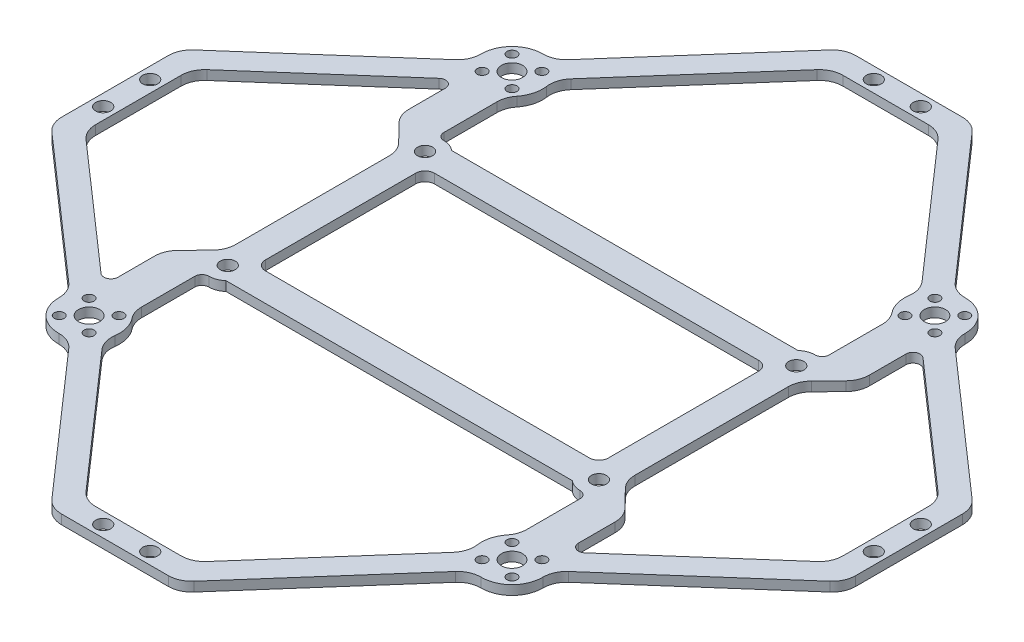
from build123d import *

# Parameters (mm, degrees)
SKETCH_1_R      = 1.6
SKETCH_1_R_2    = 2.25
SKETCH_1_R_3    = 1.05
EXTRUDE_2_DEPTH = 2


with BuildPart() as part:
    # 草图1 → 凸台-拉伸2 (new body)
    with BuildSketch(Plane(origin=(0, 0, 0), x_dir=(1, 0, 0), z_dir=(0, 1, 0))):
        with BuildLine():
            Line((-41.125061415, 53.199686028), (-15.125044792, 82.799704953))
            ThreePointArc((-15.125044792, 82.799704953), (-13.430189318, 84.055135825), (-11.368457614, 84.5))
            Line((-11.368457614, 84.5), (11.368457614, 84.5))
            ThreePointArc((11.368457614, 84.5), (13.430189318, 84.055135825), (15.125044792, 82.799704953))
            Line((15.125044792, 82.799704953), (41.125061415, 53.199686028))
            ThreePointArc((41.125061415, 53.199686028), (42.843383919, 51.933706244), (44.933105726, 51.499655772))
            ThreePointArc((44.933105726, 51.499655772), (49.596194078, 49.596194078), (51.499655772, 44.933105726))
            ThreePointArc((51.499655772, 44.933105726), (51.933706244, 42.843383919), (53.199686028, 41.125061415))
            Line((53.199686028, 41.125061415), (82.799704953, 15.125044792))
            ThreePointArc((82.799704953, 15.125044792), (84.055135825, 13.430189318), (84.5, 11.368457614))
            Line((84.5, 11.368457614), (84.5, -11.368457614))
            ThreePointArc((84.5, -11.368457614), (84.055135825, -13.430189318), (82.799704953, -15.125044792))
            Line((82.799704953, -15.125044792), (53.199686028, -41.125061415))
            ThreePointArc((53.199686028, -41.125061415), (51.933706244, -42.843383919), (51.499655772, -44.933105726))
            ThreePointArc((51.499655772, -44.933105726), (49.596194078, -49.596194078), (44.933105726, -51.499655772))
            ThreePointArc((44.933105726, -51.499655772), (42.843383919, -51.933706244), (41.125061415, -53.199686028))
            Line((41.125061415, -53.199686028), (15.125044792, -82.799704953))
            ThreePointArc((15.125044792, -82.799704953), (13.430189318, -84.055135825), (11.368457614, -84.5))
            Line((11.368457614, -84.5), (-11.368457614, -84.5))
            ThreePointArc((-11.368457614, -84.5), (-13.430189318, -84.055135825), (-15.125044792, -82.799704953))
            Line((-15.125044792, -82.799704953), (-41.125061415, -53.199686028))
            ThreePointArc((-41.125061415, -53.199686028), (-42.843383919, -51.933706244), (-44.933105726, -51.499655772))
            ThreePointArc((-44.933105726, -51.499655772), (-49.596194078, -49.596194078), (-51.499655772, -44.933105726))
            ThreePointArc((-51.499655772, -44.933105726), (-51.933706244, -42.843383919), (-53.199686028, -41.125061415))
            Line((-53.199686028, -41.125061415), (-82.799704953, -15.125044792))
            ThreePointArc((-82.799704953, -15.125044792), (-84.055135825, -13.430189318), (-84.5, -11.368457614))
            Line((-84.5, -11.368457614), (-84.5, 11.368457614))
            ThreePointArc((-84.5, 11.368457614), (-84.055135825, 13.430189318), (-82.799704953, 15.125044792))
            Line((-82.799704953, 15.125044792), (-53.199686028, 41.125061415))
            ThreePointArc((-53.199686028, 41.125061415), (-51.933706244, 42.843383919), (-51.499655772, 44.933105726))
            ThreePointArc((-51.499655772, 44.933105726), (-49.596194078, 49.596194078), (-44.933105726, 51.499655772))
            ThreePointArc((-44.933105726, 51.499655772), (-42.843383919, 51.933706244), (-41.125061415, 53.199686028))
        make_face()
        with Locations(Location((-39.5, 21, 0), (0, 0, 270))):
            Circle(SKETCH_1_R, mode=Mode.SUBTRACT)
        with Locations(Location((39.5, 21, 0), (0, 0, 270))):
            Circle(SKETCH_1_R, mode=Mode.SUBTRACT)
        with Locations(Location((39.5, -21, 0), (0, 0, 270))):
            Circle(SKETCH_1_R, mode=Mode.SUBTRACT)
        with Locations(Location((-39.5, -21, 0), (0, 0, 270))):
            Circle(SKETCH_1_R, mode=Mode.SUBTRACT)
        with Locations(Location((45, 45, 0), (0, 0, 270))):
            Circle(SKETCH_1_R_2, mode=Mode.SUBTRACT)
        with Locations(Location((48.181980515, 48.181980515, 0), (0, 0, 270))):
            Circle(SKETCH_1_R_3, mode=Mode.SUBTRACT)
        with Locations(Location((5, 82, 0), (0, 0, 270))):
            Circle(SKETCH_1_R, mode=Mode.SUBTRACT)
        with Locations(Location((-5, 82, 0), (0, 0, 270))):
            Circle(SKETCH_1_R, mode=Mode.SUBTRACT)
        with Locations(Location((82, 5, 0), (0, 0, 270))):
            Circle(SKETCH_1_R, mode=Mode.SUBTRACT)
        with Locations(Location((82, -5, 0), (0, 0, 270))):
            Circle(SKETCH_1_R, mode=Mode.SUBTRACT)
        with Locations(Location((5, -82, 0), (0, 0, 270))):
            Circle(SKETCH_1_R, mode=Mode.SUBTRACT)
        with Locations(Location((-5, -82, 0), (0, 0, 270))):
            Circle(SKETCH_1_R, mode=Mode.SUBTRACT)
        with Locations(Location((-82, -5, 0), (0, 0, 270))):
            Circle(SKETCH_1_R, mode=Mode.SUBTRACT)
        with Locations(Location((-82, 5, 0), (0, 0, 270))):
            Circle(SKETCH_1_R, mode=Mode.SUBTRACT)
        with Locations(Location((48.181980515, 41.818019485, 0), (0, 0, 270))):
            Circle(SKETCH_1_R_3, mode=Mode.SUBTRACT)
        with Locations(Location((41.818019485, 41.818019485, 0), (0, 0, 270))):
            Circle(SKETCH_1_R_3, mode=Mode.SUBTRACT)
        with Locations(Location((41.818019485, 48.181980515, 0), (0, 0, 270))):
            Circle(SKETCH_1_R_3, mode=Mode.SUBTRACT)
        with Locations(Location((48.181980515, -41.818019485, 0), (0, 0, 270))):
            Circle(SKETCH_1_R_3, mode=Mode.SUBTRACT)
        with Locations(Location((48.181980515, -48.181980515, 0), (0, 0, 270))):
            Circle(SKETCH_1_R_3, mode=Mode.SUBTRACT)
        with Locations(Location((45, -45, 0), (0, 0, 270))):
            Circle(SKETCH_1_R_2, mode=Mode.SUBTRACT)
        with Locations(Location((41.818019485, -41.818019485, 0), (0, 0, 270))):
            Circle(SKETCH_1_R_3, mode=Mode.SUBTRACT)
        with Locations(Location((41.818019485, -48.181980515, 0), (0, 0, 270))):
            Circle(SKETCH_1_R_3, mode=Mode.SUBTRACT)
        with Locations(Location((-41.818019485, -48.181980515, 0), (0, 0, 270))):
            Circle(SKETCH_1_R_3, mode=Mode.SUBTRACT)
        with Locations(Location((-48.181980515, -48.181980515, 0), (0, 0, 270))):
            Circle(SKETCH_1_R_3, mode=Mode.SUBTRACT)
        with Locations(Location((-45, -45, 0), (0, 0, 270))):
            Circle(SKETCH_1_R_2, mode=Mode.SUBTRACT)
        with Locations(Location((-41.818019485, -41.818019485, 0), (0, 0, 270))):
            Circle(SKETCH_1_R_3, mode=Mode.SUBTRACT)
        with Locations(Location((-48.181980515, -41.818019485, 0), (0, 0, 270))):
            Circle(SKETCH_1_R_3, mode=Mode.SUBTRACT)
        with Locations(Location((-48.181980515, 41.818019485, 0), (0, 0, 270))):
            Circle(SKETCH_1_R_3, mode=Mode.SUBTRACT)
        with Locations(Location((-48.181980515, 48.181980515, 0), (0, 0, 270))):
            Circle(SKETCH_1_R_3, mode=Mode.SUBTRACT)
        with Locations(Location((-45, 45, 0), (0, 0, 270))):
            Circle(SKETCH_1_R_2, mode=Mode.SUBTRACT)
        with Locations(Location((-41.818019485, 41.818019485, 0), (0, 0, 270))):
            Circle(SKETCH_1_R_3, mode=Mode.SUBTRACT)
        with Locations(Location((-41.818019485, 48.181980515, 0), (0, 0, 270))):
            Circle(SKETCH_1_R_3, mode=Mode.SUBTRACT)
        with BuildLine():
            Line((41, 37.841089468), (41, 26.5))
            ThreePointArc((41, 26.5), (40.560660172, 25.439339828), (39.5, 25))
            ThreePointArc((39.5, 25), (38.085786438, 24.741657387), (36.854248689, 24))
            Line((36.854248689, 24), (-36.854248689, 24))
            ThreePointArc((-36.854248689, 24), (-38.085786438, 24.741657387), (-39.5, 25))
            ThreePointArc((-39.5, 25), (-40.560660172, 25.439339828), (-41, 26.5))
            Line((-41, 26.5), (-41, 37.841089468))
            ThreePointArc((-41, 37.841089468), (-40.720445815, 39.489540652), (-39.913043478, 40.953659265))
            ThreePointArc((-39.913043478, 40.953659265), (-38.72889776, 43.29024075), (-38.563240512, 45.904503895))
            ThreePointArc((-38.563240512, 45.904503895), (-38.402295913, 48.032750563), (-37.368474237, 49.899981075))
            Line((-37.368474237, 49.899981075), (-12.86196002, 77.799704953))
            ThreePointArc((-12.86196002, 77.799704953), (-11.167104546, 79.055135825), (-9.105372843, 79.5))
            Line((-9.105372843, 79.5), (9.105372843, 79.5))
            ThreePointArc((9.105372843, 79.5), (11.167104546, 79.055135825), (12.86196002, 77.799704953))
            Line((12.86196002, 77.799704953), (37.368474237, 49.899981075))
            ThreePointArc((37.368474237, 49.899981075), (38.402295913, 48.032750563), (38.563240512, 45.904503895))
            ThreePointArc((38.563240512, 45.904503895), (38.72889776, 43.29024075), (39.913043478, 40.953659265))
            ThreePointArc((39.913043478, 40.953659265), (40.720445815, 39.489540652), (41, 37.841089468))
        make_face(mode=Mode.SUBTRACT)
        with BuildLine():
            Line((43.923529412, 19.803881957), (47.576470588, 23.54291939))
            ThreePointArc((47.576470588, 23.54291939), (48.630461799, 25.1505526), (49, 27.037037037))
            Line((49, 27.037037037), (49, 34.844937588))
            ThreePointArc((49, 34.844937588), (49.881480489, 36.211478336), (51.489911486, 35.971913741))
            Line((51.489911486, 35.971913741), (77.799704953, 12.86196002))
            ThreePointArc((77.799704953, 12.86196002), (79.055135825, 11.167104546), (79.5, 9.105372843))
            Line((79.5, 9.105372843), (79.5, -9.105372843))
            ThreePointArc((79.5, -9.105372843), (79.055135825, -11.167104546), (77.799704953, -12.86196002))
            Line((77.799704953, -12.86196002), (51.489911486, -35.971913741))
            ThreePointArc((51.489911486, -35.971913741), (49.881480489, -36.211478336), (49, -34.844937588))
            Line((49, -34.844937588), (49, -27.037037037))
            ThreePointArc((49, -27.037037037), (48.630461799, -25.1505526), (47.576470588, -23.54291939))
            Line((47.576470588, -23.54291939), (43.923529412, -19.803881957))
            ThreePointArc((43.923529412, -19.803881957), (42.869538201, -18.196248746), (42.5, -16.30976431))
            Line((42.5, -16.30976431), (42.5, 16.30976431))
            ThreePointArc((42.5, 16.30976431), (42.869538201, 18.196248746), (43.923529412, 19.803881957))
        make_face(mode=Mode.SUBTRACT)
        with BuildLine():
            Line((41, -26.5), (41, -37.841089468))
            ThreePointArc((41, -37.841089468), (40.720445815, -39.489540652), (39.913043478, -40.953659265))
            ThreePointArc((39.913043478, -40.953659265), (38.72889776, -43.29024075), (38.563240512, -45.904503895))
            ThreePointArc((38.563240512, -45.904503895), (38.402295913, -48.032750563), (37.368474237, -49.899981075))
            Line((37.368474237, -49.899981075), (12.86196002, -77.799704953))
            ThreePointArc((12.86196002, -77.799704953), (11.167104546, -79.055135825), (9.105372843, -79.5))
            Line((9.105372843, -79.5), (-9.105372843, -79.5))
            ThreePointArc((-9.105372843, -79.5), (-11.167104546, -79.055135825), (-12.86196002, -77.799704953))
            Line((-12.86196002, -77.799704953), (-37.368474237, -49.899981075))
            ThreePointArc((-37.368474237, -49.899981075), (-38.402295913, -48.032750563), (-38.563240512, -45.904503895))
            ThreePointArc((-38.563240512, -45.904503895), (-38.72889776, -43.29024075), (-39.913043478, -40.953659265))
            ThreePointArc((-39.913043478, -40.953659265), (-40.720445815, -39.489540652), (-41, -37.841089468))
            Line((-41, -37.841089468), (-41, -26.5))
            ThreePointArc((-41, -26.5), (-40.560660172, -25.439339828), (-39.5, -25))
            ThreePointArc((-39.5, -25), (-38.085786438, -24.741657387), (-36.854248689, -24))
            Line((-36.854248689, -24), (36.854248689, -24))
            ThreePointArc((36.854248689, -24), (38.085786438, -24.741657387), (39.5, -25))
            ThreePointArc((39.5, -25), (40.560660172, -25.439339828), (41, -26.5))
        make_face(mode=Mode.SUBTRACT)
        with BuildLine():
            Line((-49, -34.844937588), (-49, -27.037037037))
            ThreePointArc((-49, -27.037037037), (-48.630461799, -25.1505526), (-47.576470588, -23.54291939))
            Line((-47.576470588, -23.54291939), (-43.923529412, -19.803881957))
            ThreePointArc((-43.923529412, -19.803881957), (-42.869538201, -18.196248746), (-42.5, -16.30976431))
            Line((-42.5, -16.30976431), (-42.5, 16.30976431))
            ThreePointArc((-42.5, 16.30976431), (-42.869538201, 18.196248746), (-43.923529412, 19.803881957))
            Line((-43.923529412, 19.803881957), (-47.576470588, 23.54291939))
            ThreePointArc((-47.576470588, 23.54291939), (-48.630461799, 25.1505526), (-49, 27.037037037))
            Line((-49, 27.037037037), (-49, 34.844937588))
            ThreePointArc((-49, 34.844937588), (-49.881480489, 36.211478336), (-51.489911486, 35.971913741))
            Line((-51.489911486, 35.971913741), (-77.799704953, 12.86196002))
            ThreePointArc((-77.799704953, 12.86196002), (-79.055135825, 11.167104546), (-79.5, 9.105372843))
            Line((-79.5, 9.105372843), (-79.5, -9.105372843))
            ThreePointArc((-79.5, -9.105372843), (-79.055135825, -11.167104546), (-77.799704953, -12.86196002))
            Line((-77.799704953, -12.86196002), (-51.489911486, -35.971913741))
            ThreePointArc((-51.489911486, -35.971913741), (-49.881480489, -36.211478336), (-49, -34.844937588))
        make_face(mode=Mode.SUBTRACT)
        with BuildLine():
            Line((-34.5, -18), (34.5, -18))
            ThreePointArc((34.5, -18), (35.914213562, -17.414213562), (36.5, -16))
            Line((36.5, -16), (36.5, 16))
            ThreePointArc((36.5, 16), (35.914213562, 17.414213562), (34.5, 18))
            Line((34.5, 18), (-34.5, 18))
            ThreePointArc((-34.5, 18), (-35.914213562, 17.414213562), (-36.5, 16))
            Line((-36.5, 16), (-36.5, -16))
            ThreePointArc((-36.5, -16), (-35.914213562, -17.414213562), (-34.5, -18))
        make_face(mode=Mode.SUBTRACT)
    extrude(amount=EXTRUDE_2_DEPTH)


solid = part.part
